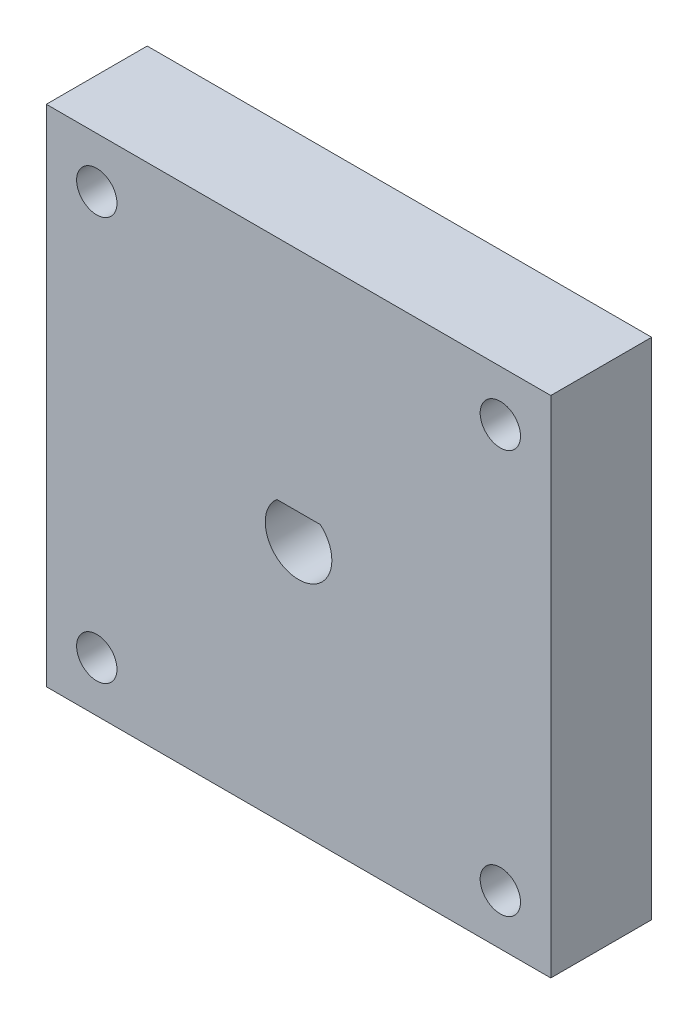
from build123d import *

# Parameters (mm, degrees)
IZIM1_W                     = 50
IZIM1_H                     = 50
IZIM1_R                     = 2
Y_KSEKLIK_EKSTR_ZYON1_DEPTH = 10


with BuildPart() as part:
    # Çizim1 → Yükseklik-Ekstrüzyon1 (new body)
    with BuildSketch(Plane.XY):
        with Locations((25, 25)):
            Rectangle(IZIM1_W, IZIM1_H)
        with Locations((5, 45)):
            Circle(IZIM1_R, mode=Mode.SUBTRACT)
        with Locations((45, 45)):
            Circle(IZIM1_R, mode=Mode.SUBTRACT)
        with Locations((45, 5)):
            Circle(IZIM1_R, mode=Mode.SUBTRACT)
        with Locations((5, 5)):
            Circle(IZIM1_R, mode=Mode.SUBTRACT)
        with BuildLine():
            Line((22.845934077, 27.5), (27.154065923, 27.5))
            ThreePointArc((27.154065923, 27.5), (25, 21.7), (22.845934077, 27.5))
        make_face(mode=Mode.SUBTRACT)
    extrude(amount=Y_KSEKLIK_EKSTR_ZYON1_DEPTH)


solid = part.part
